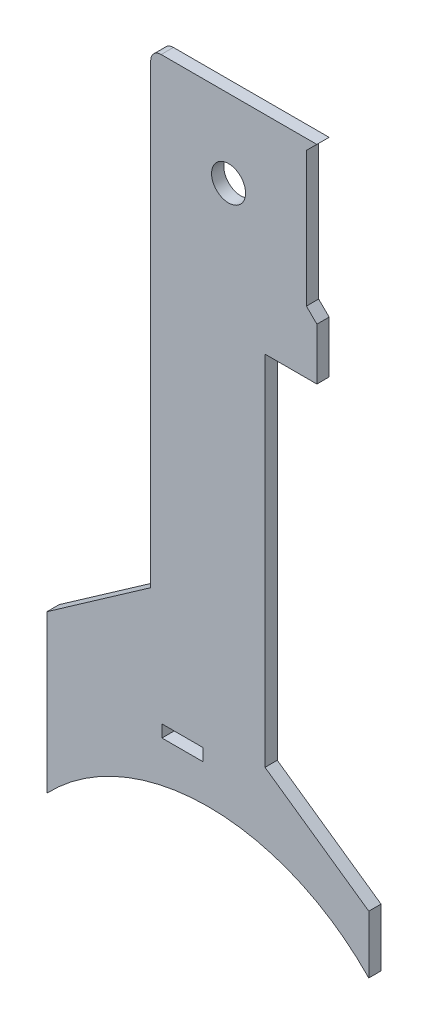
from build123d import *

# Parameters (mm, degrees)
BOSS_EXTRUDE1_DEPTH = 3
SKETCH2_R           = 4.1656
CUT_EXTRUDE1_DEPTH  = 158.283042746
SKETCH3_W           = 10.000000066
SKETCH3_H           = 3
CUT_EXTRUDE2_DEPTH  = 158.283042746


with BuildPart() as part:
    # Sketch1 → Boss-Extrude1 (new body)
    with BuildSketch(Plane(origin=(0, 0, 0), x_dir=(-1, 0, 0), z_dir=(0, 0, 1))):
        with BuildLine():
            Line((16.6878, -36.83), (54.810334268, -36.83))
            ThreePointArc((54.810334268, -36.83), (56.606385492, -36.086051224), (57.350334268, -34.29))
            Line((57.350334268, -34.29), (57.350334268, 77.47))
            Line((57.350334268, 77.47), (82.750334268, 95.25))
            Line((82.750334268, 95.25), (82.750334268, 133.721119177))
            ThreePointArc((82.750334268, 133.721119177), (43.408002592, 116.840177161), (3.980183448, 133.520475199))
            Line((3.980183448, 133.520475199), (3.980183448, 119.349325812))
            Line((3.980183448, 119.349325812), (29.380183448, 101.564054342))
            Line((29.380183448, 101.564054342), (29.380183448, 90.17))
            Line((29.380183448, 90.17), (29.380183448, 13.97))
            Line((29.380183448, 13.97), (16.680183448, 13.97))
            Line((16.680183448, 13.97), (16.680183448, 1.27))
            Line((16.680183448, 1.27), (19.250334268, -1.27))
            Line((19.250334268, -1.27), (19.250334268, -34.29))
            Line((19.250334268, -34.29), (16.6878, -36.83))
        make_face()
    extrude(amount=BOSS_EXTRUDE1_DEPTH)

    # Sketch2 → Cut-Extrude1 (cut, through all)
    with BuildSketch(Plane.XY.offset(3)):
        with Locations((-38.300334268, 17.78)):
            Circle(SKETCH2_R)
    extrude(amount=-CUT_EXTRUDE1_DEPTH, mode=Mode.SUBTRACT)

    # Sketch3 → Cut-Extrude2 (cut, through all)
    with BuildSketch(Plane.XY.offset(3)):
        with Locations((-49.602137137, -106.461390659)):
            Rectangle(SKETCH3_W, SKETCH3_H)
    extrude(amount=-CUT_EXTRUDE2_DEPTH, mode=Mode.SUBTRACT)


solid = part.part
